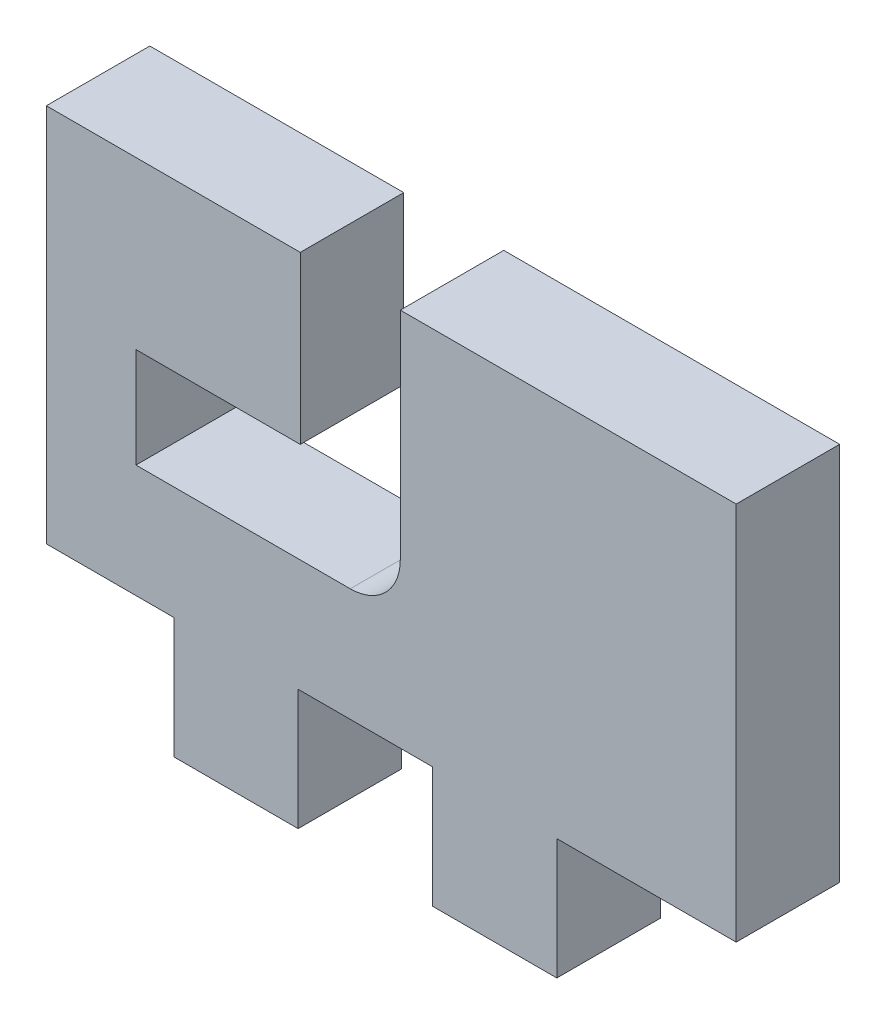
from build123d import *

# Parameters (mm, degrees)
SKETCH1_W           = 20
SKETCH1_H           = 14.5
BOSS_EXTRUDE1_DEPTH = 3
SKETCH2_W           = 3.7
SKETCH2_H           = 3.5
SKETCH2_W_2         = 3.9
SKETCH2_W_3         = 5.2
CUT_EXTRUDE1_DEPTH  = 3
CUT_EXTRUDE2_DEPTH  = 3
SKETCH4_W           = 6.213336345
SKETCH4_H           = 2.9
CUT_EXTRUDE3_DEPTH  = 10


with BuildPart() as part:
    # Sketch1 → Boss-Extrude1 (new body)
    with BuildSketch(Plane.XY):
        with Locations((2.116182573, -2.915975104)):
            Rectangle(SKETCH1_W, SKETCH1_H)
    extrude(amount=BOSS_EXTRUDE1_DEPTH)

    # Sketch2 → Cut-Extrude1 (cut)
    with BuildSketch(Plane.XY.offset(3)):
        with Locations((-6.033817427, -8.415975104)):
            Rectangle(SKETCH2_W, SKETCH2_H)
        with Locations((1.366182573, -8.415975104)):
            Rectangle(SKETCH2_W_2, SKETCH2_H)
        with Locations((9.516182573, -8.415975104)):
            Rectangle(SKETCH2_W_3, SKETCH2_H)
    extrude(amount=-CUT_EXTRUDE1_DEPTH, mode=Mode.SUBTRACT)

    # Sketch3 → Cut-Extrude2 (cut)
    with BuildSketch(Plane.XY.offset(3)):
        with BuildLine():
            Line((2.377974825, 4.334024896), (2.377974825, -1.938179145))
            ThreePointArc((2.377974825, -1.938179145), (0.927974825, -3.388179145), (-0.522025175, -1.938179145))
            Line((-0.522025175, -1.938179145), (-0.522025175, 4.334024896))
            ThreePointArc((-0.522025175, 4.334024896), (0.927974825, 5.784024896), (2.377974825, 4.334024896))
        make_face()
    extrude(amount=-CUT_EXTRUDE2_DEPTH, mode=Mode.SUBTRACT)

    # Sketch4 → Cut-Extrude3 (cut)
    with BuildSketch(Plane.XY.offset(3)):
        with Locations((-2.178693348, -1.938179145)):
            Rectangle(SKETCH4_W, SKETCH4_H)
    extrude(amount=-CUT_EXTRUDE3_DEPTH, mode=Mode.SUBTRACT)


solid = part.part
